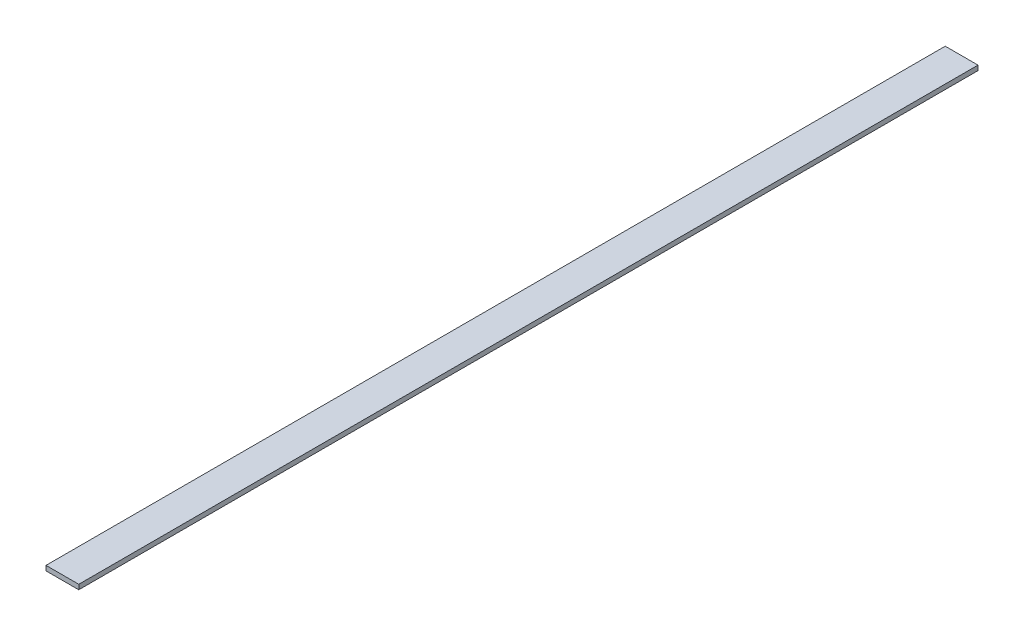
from build123d import *

# Parameters (mm, degrees)
SCHIZZO1_W                   = 8.2
SCHIZZO1_H                   = 1.2
ESTRUSIONE_ESTRUSIONE1_DEPTH = 225


with BuildPart() as part:
    # Schizzo1 → Estrusione-Estrusione1 (new body)
    with BuildSketch(Plane.XY):
        Rectangle(SCHIZZO1_W, SCHIZZO1_H)
    extrude(amount=ESTRUSIONE_ESTRUSIONE1_DEPTH)


solid = part.part
